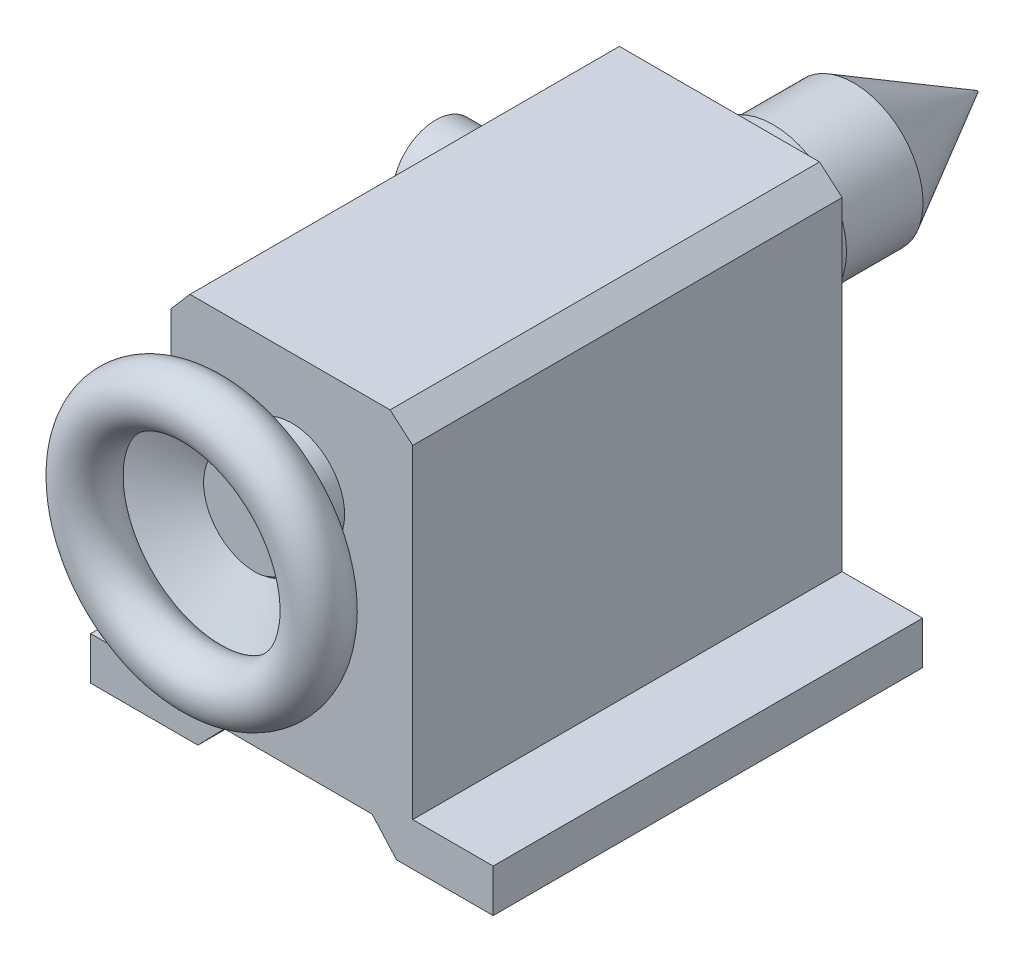
from build123d import *

# Parameters (mm, degrees)
BOSS_EXTRUDE1_DEPTH = 80
SKETCH2_R           = 13.671227571
BOSS_EXTRUDE2_DEPTH = 10
SKETCH3_R           = 12.913852374
BOSS_EXTRUDE3_DEPTH = 15
SKETCH4_R           = 12.913852374
BOSS_EXTRUDE4_DEPTH = 23
BOSS_EXTRUDE4_TAPER = 29
SKETCH5_R           = 1.573315865
BOSS_EXTRUDE5_DEPTH = 5
SKETCH6_R           = 8.066547916
BOSS_EXTRUDE6_DEPTH = 8
SKETCH7_R           = 9.826340438
BOSS_EXTRUDE7_DEPTH = 8
BOSS_EXTRUDE8_DEPTH = 8
SKETCH9_R           = 5.089016131
SKETCH10_W          = 8
SKETCH10_H          = 10.271927907
CUT_EXTRUDE1_DEPTH  = 8
SKETCH11_W          = 1.076796548
SKETCH11_H          = 5.239660712
BOSS_EXTRUDE9_DEPTH = 10
SKETCH13_W          = 10
SKETCH13_H          = 5.239660712
CUT_EXTRUDE2_DEPTH  = 10


with BuildPart() as part:
    # Sketch1 → Boss-Extrude1 (new body)
    with BuildSketch(Plane.XY):
        Polygon((15, 67.934164541), (15, 8), (60.009609738, 8), (60.009609738, 68.359810191), (55.797912777, 72), (18.514121016, 72), align=None)
        Polygon((0, 8), (0, 0), (15, 0), (15, 5.109069118), (15, 8), align=None)
        Polygon((15, 5.109069118), (15, 0), (20, 0), (24.93587091, 5.109069118), align=None)
        Polygon((15, 8), (15, 5.109069118), (24.93587091, 5.109069118), (25.209869702, 5.109069118), (51.99666462, 5.109069118), (52.437595414, 5.109069118), (60.009609738, 5.109069118), (60.009609738, 8), align=None)
        Polygon((52.437595414, 5.109069118), (57, 0), (60.009609738, 0), (60.009609738, 5.109069118), align=None)
        Polygon((75, 8), (60.009609738, 8), (60.009609738, 5.109069118), (60.009609738, 0), (75, 0), align=None)
    extrude(amount=BOSS_EXTRUDE1_DEPTH)

    # Sketch2 → Boss-Extrude2 (add)
    with BuildSketch(Plane(origin=(0, 0, 0), x_dir=(-1, 0, 0), z_dir=(0, 0, -1))):
        with Locations(Location((-37.156016896, 50.028790428, 0), (0, 0, 180))):
            Circle(SKETCH2_R)
    extrude(amount=BOSS_EXTRUDE2_DEPTH)

    # Sketch3 → Boss-Extrude3 (add)
    with BuildSketch(Plane(origin=(0, 0, -10), x_dir=(-1, 0, 0), z_dir=(0, 0, -1))):
        with Locations((-37.156016896, 50.028790428)):
            Circle(SKETCH3_R)
    extrude(amount=BOSS_EXTRUDE3_DEPTH)

    # Sketch4 → Boss-Extrude4 (add)
    with BuildSketch(Plane(origin=(0, 0, -25), x_dir=(-1, 0, 0), z_dir=(0, 0, -1))):
        with Locations((-37.156016896, 50.028790428)):
            Circle(SKETCH4_R)
    extrude(amount=BOSS_EXTRUDE4_DEPTH, taper=BOSS_EXTRUDE4_TAPER)

    # Sketch5 → Boss-Extrude5 (add)
    with BuildSketch(Plane.ZY.offset(-15)):
        with Locations((17.698538023, 52.6587383)):
            Circle(SKETCH5_R)
    extrude(amount=BOSS_EXTRUDE5_DEPTH)

    # Sketch6 → Boss-Extrude6 (add)
    with BuildSketch(Plane.ZY.offset(-10)):
        with Locations((17.698538023, 52.6587383)):
            Circle(SKETCH6_R)
    extrude(amount=BOSS_EXTRUDE6_DEPTH)

    # Sketch7 → Boss-Extrude7 (add)
    with BuildSketch(Plane.XY.offset(80)):
        with Locations((37.5, 50.88478442)):
            Circle(SKETCH7_R)
    extrude(amount=BOSS_EXTRUDE7_DEPTH)

    # Sketch8 → Boss-Extrude8 (add)
    with BuildSketch(Plane.XY.offset(80)):
        Polygon((38.686733162, 32.338247922), (38.686733162, 22.066320015), (39.377357569, 22.066320015), (40.067981977, 32.338247922), align=None)
    extrude(amount=BOSS_EXTRUDE8_DEPTH)

    # Sketch10 → Cut-Extrude1 (cut)
    with BuildSketch(Plane.ZY.offset(-38.686733162)):
        with Locations((84, 27.202283969)):
            Rectangle(SKETCH10_W, SKETCH10_H)
    extrude(amount=-CUT_EXTRUDE1_DEPTH, mode=Mode.SUBTRACT)

    # Sketch11 → Boss-Extrude9 (add)
    with BuildSketch(Plane.XY.offset(80)):
        with Locations((39.225131436, 7.728899474)):
            Rectangle(SKETCH11_W, SKETCH11_H)
    extrude(amount=BOSS_EXTRUDE9_DEPTH)



with BuildPart() as body_2:
    # Sketch9 → Revolve1 (revolve)
    with BuildSketch(Plane.ZY.offset(-38.686733162), mode=Mode.PRIVATE) as revolve1_sk:
        with Locations((98, 72.711124859)):
            Circle(SKETCH9_R)
    revolve(revolve1_sk.sketch.rotate(Axis((38.686733162, 50.911124859, 88), (0, 0, 1)), 270), axis=Axis((38.686733162, 50.911124859, 88), (0, 0, 1)))


with BuildPart() as part_1:
    add(part.part)

    add(body_2.part)  # Revolve2 merges body 2
    # Sketch12 → Revolve2 (revolve)
    with BuildSketch(Plane.ZY.offset(-38.686733162), mode=Mode.PRIVATE) as revolve2_sk:
        Polygon((93.421727235, 30.257495762), (87.972669159, 41.310242944), (87.461925794, 41.058443982), (92.910983869, 30.0056968), align=None)
    revolve(revolve2_sk.sketch.rotate(Axis((38.686733162, 50.88478442, 88), (0, 0, 1)), 183.461929318), axis=Axis((38.686733162, 50.88478442, 88), (0, 0, 1)))

    # Sketch13 → Cut-Extrude2 (cut)
    with BuildSketch(Plane.ZY.offset(-38.686733162)):
        with Locations((85, 7.728899474)):
            Rectangle(SKETCH13_W, SKETCH13_H)
    extrude(amount=-CUT_EXTRUDE2_DEPTH, mode=Mode.SUBTRACT)


solid = part_1.part
